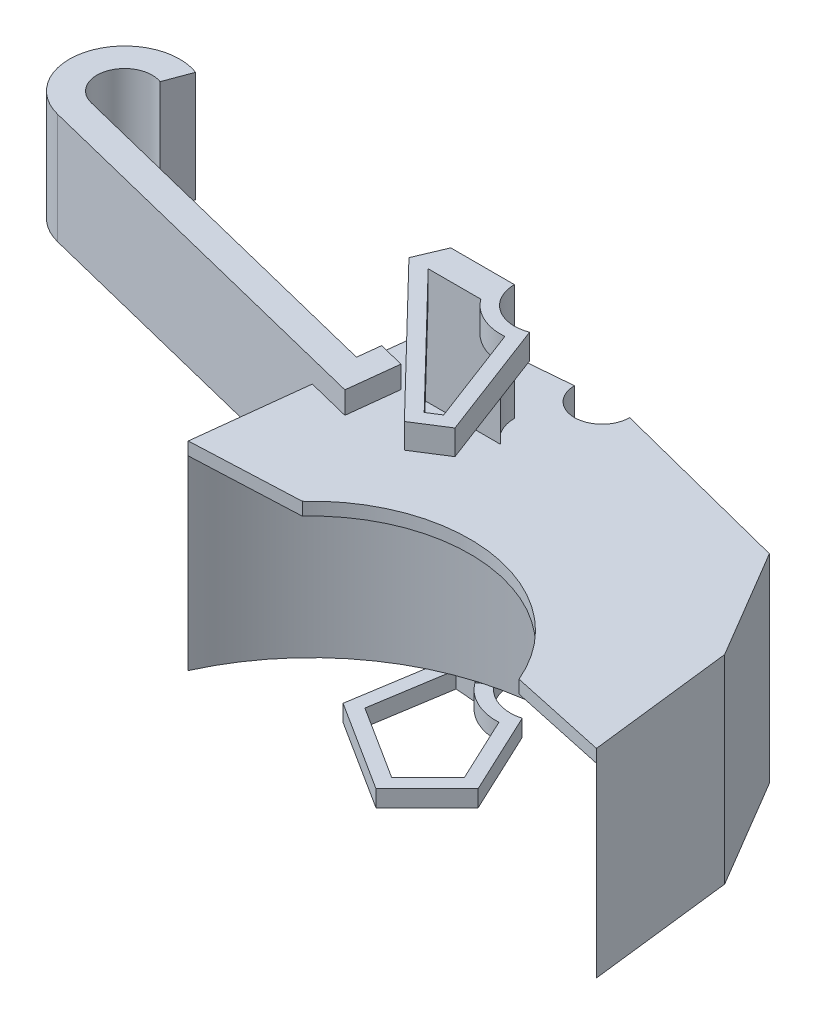
from build123d import *

# Parameters (mm, degrees)
BOSS_EXTRUDE1_DEPTH       = 15.24
BOSS_EXTRUDE1_DEPTH_BACK  = 76.2
BOSS_EXTRUDE2_DEPTH       = 11.43
SHELL3_T                  = -6.35
BOSS_EXTRUDE9_REACH       = 580.52
BOSS_EXTRUDE4_DEPTH       = 7.62
SHELL4_T                  = -6.35
BOSS_EXTRUDE10_START      = -5.936799282
BOSS_EXTRUDE10_DEPTH      = 5.936799282
BOSS_EXTRUDE11_DEPTH      = 25.4
BOSS_EXTRUDE11_DEPTH_BACK = 25.4
BOSS_EXTRUDE12_REACH      = 744.722


with BuildPart() as part:
    # Sketch3 → Boss-Extrude1 (new, two sides: drawn at the far end of the back side and taken through both)
    with BuildSketch(Plane(origin=(0, 0, 0), x_dir=(1, 0, 0), z_dir=(0, 1, 0)).offset(-BOSS_EXTRUDE1_DEPTH_BACK)):
        with BuildLine():
            Line((-475.154754325, -2.10083146), (-501.46472086, -4.34467525))
            Line((-501.46472086, -4.34467525), (-530.970406525, -16.925757689))
            Line((-530.970406525, -16.925757689), (-541.959235577, -112.906916108))
            ThreePointArc((-541.959235577, -112.906916108), (-423.220596764, -47.00180275), (-325.667958287, -141.478419116))
            Line((-325.667958287, -141.478419116), (-333.580935141, -74.592900266))
            Line((-333.580935141, -74.592900266), (-363.451088866, -24.174556876))
            Line((-363.451088866, -24.174556876), (-449.754754325, -2.10083146))
            ThreePointArc((-449.754754325, -2.10083146), (-462.454754325, -14.800833325), (-475.154754325, -2.10083146))
        make_face()
    extrude(amount=BOSS_EXTRUDE1_DEPTH + BOSS_EXTRUDE1_DEPTH_BACK)

    # Boss-Extrude9: up to this face of the body (flat: up to its plane)
    boss_extrude9_end = Plane(part.part.faces().sort_by_distance((-443.624527124, 15.24, 42.595574003))[0])
    # Sketch11 → Boss-Extrude9 (add, up to the picked face)
    with BuildSketch(Plane(origin=(0, 68.54, 0), x_dir=(1, 0, 0), z_dir=(0, 1, 0)), mode=Mode.PRIVATE) as boss_extrude9_sk1:
        with BuildLine():
            Line((-505.199519379, -28.941561379), (-510.924193781, -42.454904444))
            Line((-510.924193781, -42.454904444), (-468.930038741, -42.454904444))
            ThreePointArc((-468.930038741, -42.454904444), (-474.068166901, -36.548395666), (-475.918740123, -28.941649602))
            Line((-475.918740123, -28.941649602), (-505.199519379, -28.941561379))
        make_face()
    boss_extrude9_tool1 = split(extrude(boss_extrude9_sk1.sketch, amount=-BOSS_EXTRUDE9_REACH, mode=Mode.PRIVATE), bisect_by=boss_extrude9_end, keep=Keep.BOTH, mode=Mode.PRIVATE)


with BuildPart() as body_2:
    # Sketch4 → Boss-Extrude2 (new body)
    with BuildSketch(Plane(origin=(0, 68.54, 0), x_dir=(1, 0, 0), z_dir=(0, 1, 0))):
        with BuildLine():
            Line((-505.199519379, -28.941561379), (-510.924193781, -42.454904444))
            Line((-510.924193781, -42.454904444), (-446.727083924, -108.742597242))
            Line((-446.727083924, -108.742597242), (-432.506297568, -99.706904201))
            Line((-432.506297568, -99.706904201), (-453.485090126, -44.423263798))
            ThreePointArc((-453.485090126, -44.423263798), (-468.76509838, -42.570216845), (-475.918740123, -28.941649602))
            Line((-475.918740123, -28.941649602), (-505.199519379, -28.941561379))
        make_face()
    extrude(amount=-BOSS_EXTRUDE2_DEPTH)

    # Shell3
    shell3_openings = [body_2.faces().sort_by_distance(p)[0] for p in [
        (-469.398872601, 57.11, 63.557756805),
        (-469.398872601, 68.54, 63.557756805),
    ]]
    offset(amount=SHELL3_T, openings=shell3_openings, kind=Kind.INTERSECTION)


with BuildPart() as part_1:
    add(part.part)

    add(body_2.part)  # Boss-Extrude9 merges body 2
    add(boss_extrude9_tool1.solids().sort_by(Axis((-490.927934, 68.54, 36.102447), (0, -1, 0)))[0])

    # Sketch8 → Boss-Extrude10 (add)
    with BuildSketch(Plane(origin=(0, 15.24, 0), x_dir=(1, 0, 0), z_dir=(0, 1, 0)).offset(BOSS_EXTRUDE10_START)):
        with BuildLine():
            Line((-371.049471839, -131.701729119), (-325.667958287, -141.478419116))
            ThreePointArc((-325.667958287, -141.478419116), (-423.220596764, -47.00180275), (-541.959235577, -112.906916108))
            Line((-541.959235577, -112.906916108), (-491.729175354, -110.68768413))
            ThreePointArc((-491.729175354, -110.68768413), (-425.655830818, -88.268337191), (-371.049471839, -131.701729119))
        make_face()
    extrude(amount=BOSS_EXTRUDE10_DEPTH)

    # Sketch9 → Boss-Extrude11 (add, two sides: drawn at the far end of the back side and taken through both)
    with BuildSketch(Plane(origin=(0, 0, 0), x_dir=(1, 0, 0), z_dir=(0, 1, 0)).offset(-BOSS_EXTRUDE11_DEPTH_BACK)):
        with BuildLine():
            Line((-676.938792406, 25.463963625), (-681.369396203, 13.561873472))
            ThreePointArc((-681.369396203, 13.561873472), (-697.932826151, 5.412719448), (-688.863344118, -10.665228762))
            Line((-688.863344118, -10.665228762), (-526.489446237, -51.02276527))
            Line((-526.489446237, -51.02276527), (-525.298257919, -40.618414259))
            Line((-525.298257919, -40.618414259), (-513.502810151, -43.550136784))
            Line((-513.502810151, -43.550136784), (-516.15079803, -66.678801621))
            Line((-516.15079803, -66.678801621), (-691.926688237, -22.990240843))
            ThreePointArc((-691.926688237, -22.990240843), (-710.065652303, 9.165655576), (-676.938792406, 25.463963625))
        make_face()
    extrude(amount=BOSS_EXTRUDE11_DEPTH + BOSS_EXTRUDE11_DEPTH_BACK)

    # Boss-Extrude12: up to this face of the body (flat: up to its plane)
    boss_extrude12_end = Plane(part_1.part.faces().sort_by_distance((-443.624527124, -76.2, 42.595574003))[0])
    # Sketch12 → Boss-Extrude12 (add, up to the picked face)
    with BuildSketch(Plane.XZ.offset(92.130800062), mode=Mode.PRIVATE) as boss_extrude12_sk1:
        with BuildLine():
            Line((-493.29786016, 29.59254273), (-477.784324755, 30.750375257))
            ThreePointArc((-477.784324755, 30.750375257), (-476.661333768, 35.528904506), (-474.321994889, 39.844335441))
            Line((-474.321994889, 39.844335441), (-479.53607938, 43.470681078))
            Line((-479.53607938, 43.470681078), (-495.321687866, 42.29254273))
            Line((-495.321687866, 42.29254273), (-493.29786016, 29.59254273))
        make_face()
    boss_extrude12_tool1 = split(extrude(boss_extrude12_sk1.sketch, amount=-BOSS_EXTRUDE12_REACH, mode=Mode.PRIVATE), bisect_by=boss_extrude12_end, keep=Keep.BOTH, mode=Mode.PRIVATE)


with BuildPart() as body_2_2:
    # Sketch6 → Boss-Extrude4 (new body)
    with BuildSketch(Plane.XZ.offset(92.130800062)):
        with BuildLine():
            Line((-493.29786016, 29.59254273), (-501.65329384, 82.024875489))
            Line((-501.65329384, 82.024875489), (-460.055244029, 108.470724329))
            Line((-460.055244029, 108.470724329), (-436.590495923, 84.974770196))
            Line((-436.590495923, 84.974770196), (-454.490501674, 46.803141976))
            ThreePointArc((-454.490501674, 46.803141976), (-469.864919046, 44.185661822), (-477.784324755, 30.750375257))
            Line((-477.784324755, 30.750375257), (-493.29786016, 29.59254273))
        make_face()
    extrude(amount=-BOSS_EXTRUDE4_DEPTH)

    # Shell4
    shell4_openings = [body_2_2.faces().sort_by_distance(p)[0] for p in [
        (-471.64936301, -84.510800062, 70.060968027),
        (-471.64936301, -92.130800062, 70.060968027),
    ]]
    offset(amount=SHELL4_T, openings=shell4_openings, kind=Kind.INTERSECTION)


with BuildPart() as part_2:
    add(part_1.part)

    add(body_2_2.part)  # Boss-Extrude12 merges body 2 2
    add(boss_extrude12_tool1.solids().sort_by(Axis((-485.45228, -92.1308, 36.761722), (0, 1, 0)))[0])


solid = part_2.part
